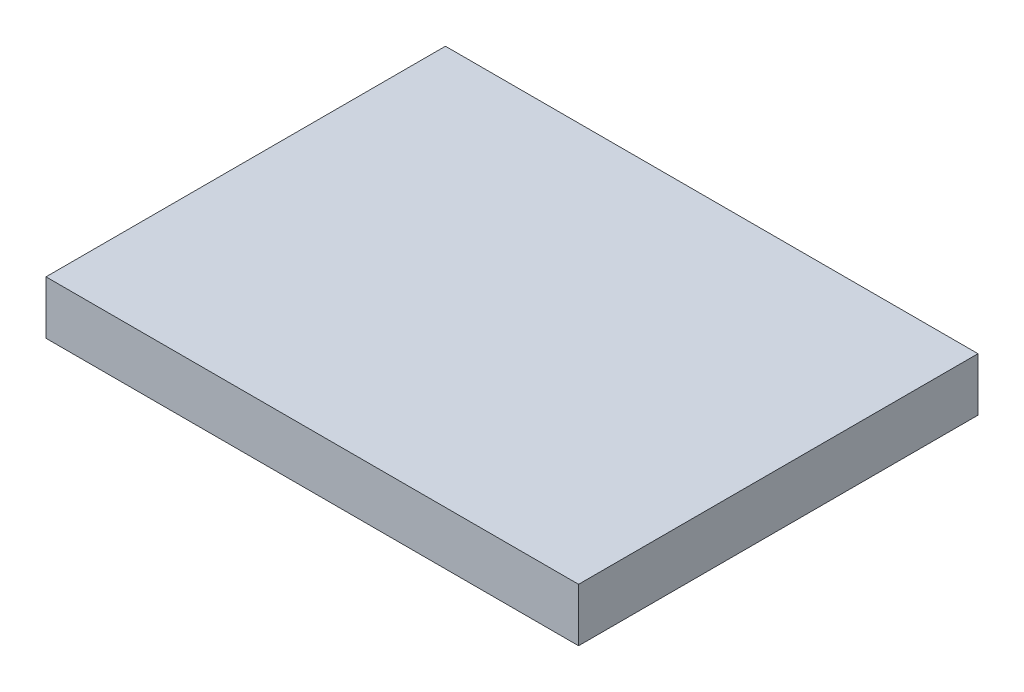
from build123d import *

# Parameters (mm, degrees)
SKETCH1_W           = 40
SKETCH1_H           = 30
BOSS_EXTRUDE1_DEPTH = 4


with BuildPart() as part:
    # Sketch1 → Boss-Extrude1 (new body)
    with BuildSketch(Plane(origin=(0, 0, 0), x_dir=(1, 0, 0), z_dir=(0, 1, 0))):
        with Locations((-20, 15)):
            Rectangle(SKETCH1_W, SKETCH1_H)
    extrude(amount=BOSS_EXTRUDE1_DEPTH)


solid = part.part
